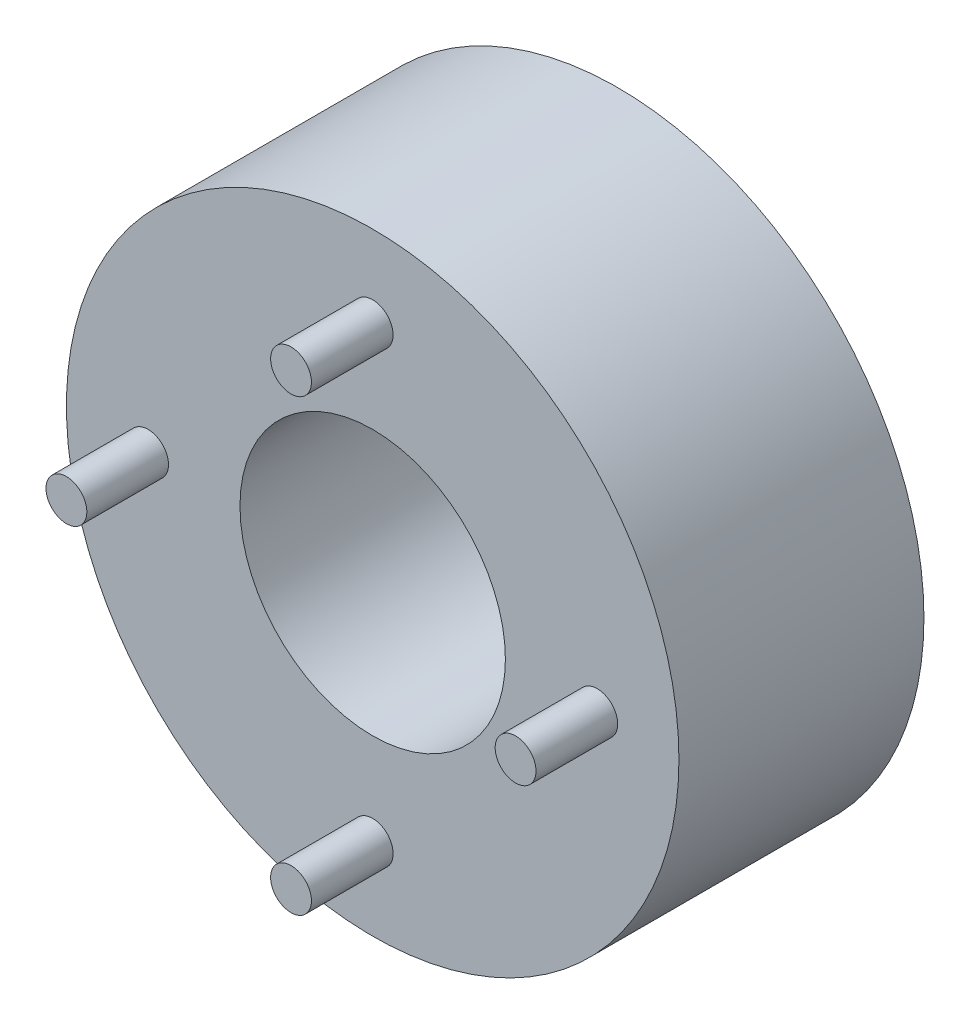
from build123d import *

# Parameters (mm, degrees)
SZKIC1_R                    = 7.5
SZKIC1_R_2                  = 3.25
DODANIE_WYCI_GNI_CIE1_DEPTH = 4
SZKIC2_R                    = 7.5
SZKIC2_R_2                  = 3.25
DODANIE_WYCI_GNI_CIE2_DEPTH = 2
SZKIC3_R                    = 0.5
DODANIE_WYCI_GNI_CIE3_DEPTH = 2


with BuildPart() as part:
    # Szkic1 → Dodanie-wyciągnięcie1 (new body)
    with BuildSketch(Plane.XY):
        Circle(SZKIC1_R)
        Circle(SZKIC1_R_2, mode=Mode.SUBTRACT)
    extrude(amount=DODANIE_WYCI_GNI_CIE1_DEPTH)

    # Szkic2 → Dodanie-wyciągnięcie2 (add)
    with BuildSketch(Plane.XY.offset(4)):
        Circle(SZKIC2_R)
        Circle(SZKIC2_R_2, mode=Mode.SUBTRACT)
    extrude(amount=DODANIE_WYCI_GNI_CIE2_DEPTH)

    # Szkic3 → Dodanie-wyciągnięcie3 (add)
    with BuildSketch(Plane.XY.offset(6)):
        with Locations((0, 5.5)):
            Circle(SZKIC3_R)
        with Locations((5.5, 0)):
            Circle(SZKIC3_R)
        with Locations((0, -5.5)):
            Circle(SZKIC3_R)
        with Locations((-5.5, 0)):
            Circle(SZKIC3_R)
    extrude(amount=DODANIE_WYCI_GNI_CIE3_DEPTH)


solid = part.part
